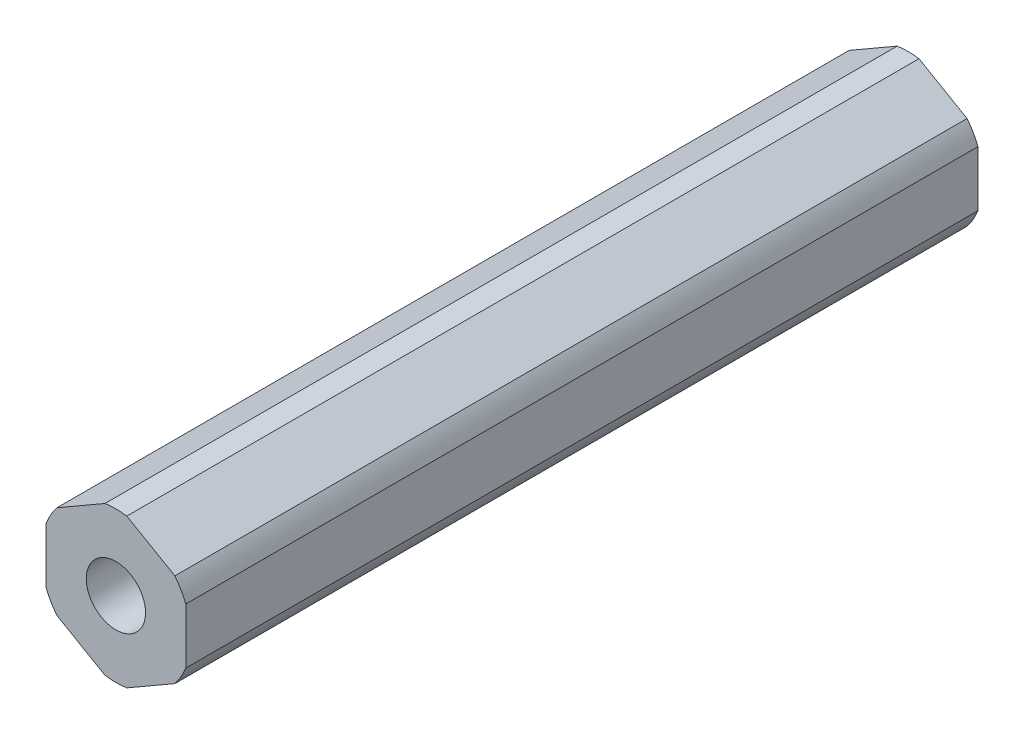
from build123d import *

# Parameters (mm, degrees)
BOSS_EXTRUDE1_DEPTH = 26.9875
SKETCH2_R           = 2.0193
CUT_EXTRUDE1_DEPTH  = 19.05


with BuildPart() as part:
    # Sketch1 → Boss-Extrude1 (new, symmetric)
    with BuildSketch(Plane.XY):
        with BuildLine():
            ThreePointArc((4.7625, 1.891713919), (4.43790388, 2.562225), (4.019522311, 3.178589026))
            Line((4.019522311, 3.178589026), (0.742977689, 5.070302945))
            ThreePointArc((0.742977689, 5.070302945), (0, 5.12445), (-0.742977689, 5.070302945))
            Line((-0.742977689, 5.070302945), (-4.019522311, 3.178589026))
            ThreePointArc((-4.019522311, 3.178589026), (-4.43790388, 2.562225), (-4.7625, 1.891713919))
            Line((-4.7625, 1.891713919), (-4.7625, -1.891713919))
            ThreePointArc((-4.7625, -1.891713919), (-4.43790388, -2.562225), (-4.019522311, -3.178589026))
            Line((-4.019522311, -3.178589026), (-0.742977689, -5.070302945))
            ThreePointArc((-0.742977689, -5.070302945), (0, -5.12445), (0.742977689, -5.070302945))
            Line((0.742977689, -5.070302945), (4.019522311, -3.178589026))
            ThreePointArc((4.019522311, -3.178589026), (4.43790388, -2.562225), (4.7625, -1.891713919))
            Line((4.7625, -1.891713919), (4.7625, 1.891713919))
        make_face()
    extrude(amount=BOSS_EXTRUDE1_DEPTH, both=True)

    # Sketch2 → Cut-Extrude1 (cut)
    with BuildSketch(Plane(origin=(0, 0, -26.9875), x_dir=(-1, 0, 0), z_dir=(0, 0, -1))):
        Circle(SKETCH2_R)
    cut_extrude1 = extrude(amount=-CUT_EXTRUDE1_DEPTH, mode=Mode.SUBTRACT)

    # Mirror1: Cut-Extrude1 across plane
    add(cut_extrude1.mirror(Plane.XY), mode=Mode.SUBTRACT)


solid = part.part
